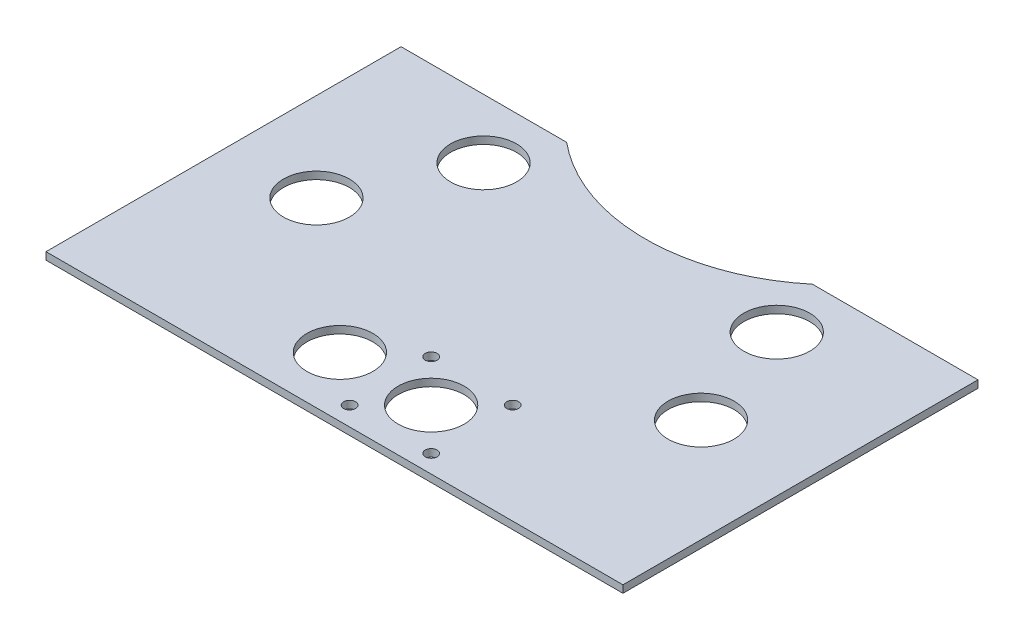
from build123d import *

# Parameters (mm, degrees)
BOSS_EXTRUDE1_DEPTH     = 3.175
F_1_1_115_DOWEL_HOLE1_D = 28.321
F_10_CLEARANCE_HOLE1_D  = 5.1054
F_1_1_115_DOWEL_HOLE3_D = 28.321
SKETCH11_R              = 14.1605
CUT_EXTRUDE1_DEPTH      = 158.031276025
SKETCH12_R              = 14.1605
CUT_EXTRUDE2_DEPTH      = 158.031276025


with BuildPart() as part:
    # Sketch1 → Boss-Extrude1 (new body)
    with BuildSketch(Plane(origin=(0, 0, 0), x_dir=(1, 0, 0), z_dir=(0, 1, 0))):
        with BuildLine():
            Line((-123.825, -55.88), (123.825, -55.88))
            Line((123.825, -55.88), (123.825, 96.52))
            Line((123.825, 96.52), (52.74706153, 96.52))
            ThreePointArc((52.74706153, 96.52), (0, 77.47), (-52.74706153, 96.52))
            Line((-52.74706153, 96.52), (-123.825, 96.52))
            Line((-123.825, 96.52), (-123.825, -55.88))
        make_face()
    extrude(amount=BOSS_EXTRUDE1_DEPTH)

    # 1 (1.115) Dowel Hole1 (through all)
    with Locations(Plane(origin=(0, 3.175, 0), x_dir=(1, 0, 0), z_dir=(0, 1, 0))):
        with Locations((15.875, -30.256942448)):
            Hole(F_1_1_115_DOWEL_HOLE1_D / 2)

    # #10 Clearance Hole1 (through all)
    with Locations(Plane(origin=(0, 3.175, 0), x_dir=(1, 0, 0), z_dir=(0, 1, 0))):
        with Locations((-1.625, -47.756942448), (33.375, -12.756942448), (-2.085512242, -12.296430205), (33.835512242, -48.21745469)):
            Hole(F_10_CLEARANCE_HOLE1_D / 2)

    # 1 (1.115) Dowel Hole3 (through all)
    with Locations(Plane(origin=(-3.175, -34.925, 0), x_dir=(-1, 0, 0), z_dir=(0, -1, 0))):
        with Locations((82.55, 22.098), (-82.55, 22.098)):
            Hole(F_1_1_115_DOWEL_HOLE3_D / 2)

    # Sketch11 → Cut-Extrude1 (cut, through all)
    with BuildSketch(Plane(origin=(0, 3.175, 0), x_dir=(1, 0, 0), z_dir=(0, 1, 0))):
        with Locations(Location((-23.3045, -30.256942448, 0), (0, 0, 270))):
            Circle(SKETCH11_R)
    extrude(amount=-CUT_EXTRUDE1_DEPTH, mode=Mode.SUBTRACT)

    # Sketch12 → Cut-Extrude2 (cut, through all)
    with BuildSketch(Plane(origin=(0, 3.175, 0), x_dir=(1, 0, 0), z_dir=(0, 1, 0))):
        with Locations(Location((-62.933495539, 71.035024331, 0), (0, 0, 270))):
            Circle(SKETCH12_R)
    cut_extrude2 = extrude(amount=-CUT_EXTRUDE2_DEPTH, mode=Mode.SUBTRACT)

    # Mirror2: Cut-Extrude2 across plane
    add(cut_extrude2.mirror(Plane(origin=(0, 0, 0), x_dir=(0, 0, 1), z_dir=(1, 0, 0))), mode=Mode.SUBTRACT)


solid = part.part
